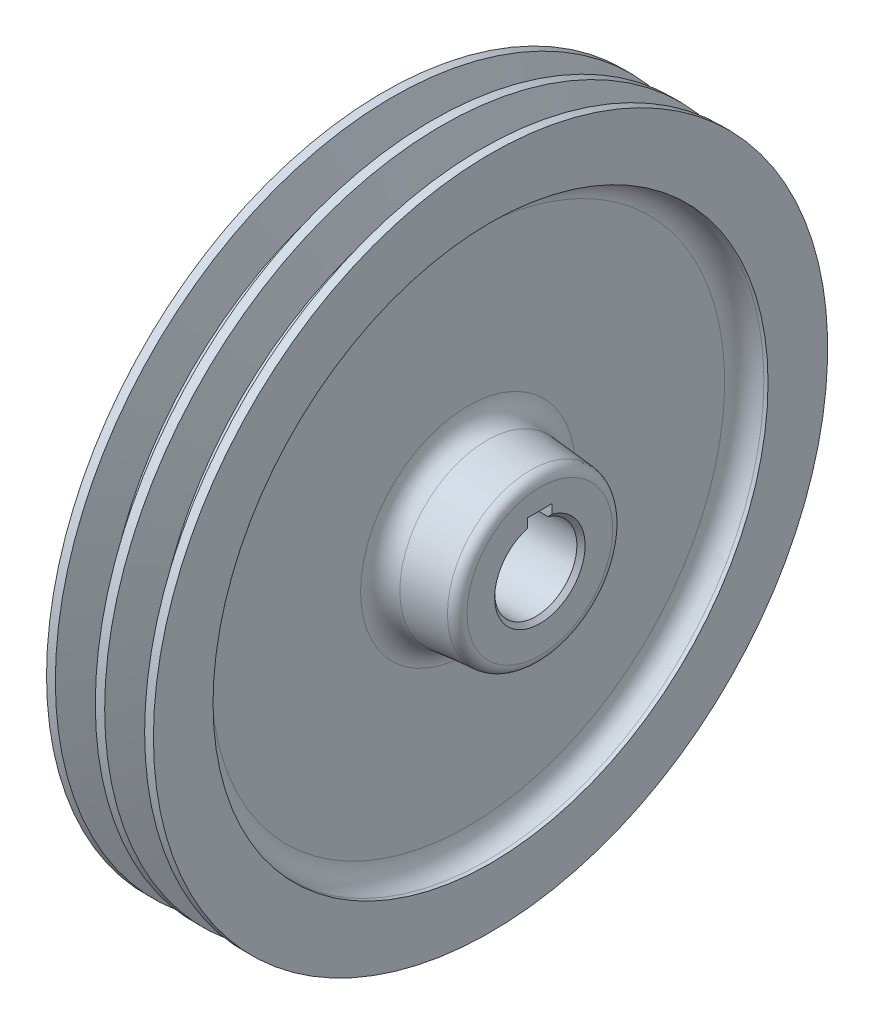
from build123d import *

# Parameters (mm, degrees)
PATTERN_LINEAR_999_COUNT = 2
PATTERN_LINEAR_999_PITCH = 12
CHAMFER_1_SIZE           = 1
SKETCH_4_W               = 6
SKETCH_4_H               = 3.260607938
CUT_EXTRUDE_1_DEPTH      = 127.285391079
FILLET_1_R               = 5
FILLET_2_R               = 2.5


with BuildPart() as part:
    # 草图1 → 旋转1 (revolve)
    with BuildSketch(Plane.XY, mode=Mode.PRIVATE) as revolve_1_sk:
        Polygon((-12, 10), (-12, 20), (5.5, 21.531051612), (5.5, 67.018812351), (0, 67.5), (0, 82), (26, 82), (26, 67.5), (20.5, 67.018812351), (20.5, 21.531051612), (38, 20), (38, 10), align=None)
    revolve(revolve_1_sk.sketch.rotate(Axis((0, 0, 0), (1, 0, 0)), 90), axis=Axis((0, 0, 0), (1, 0, 0)))

    # 草图2 → 切除-旋转1 (revolve, cut)
    with BuildSketch(Plane.XY, mode=Mode.PRIVATE) as cut_revolve_1_sk:
        Polygon((9.10988523, 73), (11.861461363, 82), (2.138538637, 82), (4.89011477, 73), align=None)
    cut_revolve_1 = revolve(cut_revolve_1_sk.sketch.rotate(Axis((0, 0, 0), (1, 0, 0)), 90), axis=Axis((0, 0, 0), (1, 0, 0)), mode=Mode.SUBTRACT)

    # Pattern Linear 999: 切除-旋转1 ×2
    with Locations(*[(i * PATTERN_LINEAR_999_PITCH, 0, 0) for i in range(1, PATTERN_LINEAR_999_COUNT)]):
        add(cut_revolve_1, mode=Mode.SUBTRACT)

    # 倒角1
    chamfer_1_edges = [part.edges().sort_by_distance(p)[0] for p in [
        (-12, 0, -10),
        (38, 0, -10),
    ]]
    chamfer(chamfer_1_edges, length=CHAMFER_1_SIZE)

    # 草图4 → 切除-拉伸1 (cut, through all)
    with BuildSketch(Plane.ZY.offset(12)):
        with Locations((0, 11.169695983)):
            Rectangle(SKETCH_4_W, SKETCH_4_H)
    extrude(amount=-CUT_EXTRUDE_1_DEPTH, mode=Mode.SUBTRACT)

    # 圆角1
    fillet_1_edges = [part.edges().sort_by_distance(p)[0] for p in [
        (5.5, 0, -67.018812351),
        (5.5, 0, -21.531051612),
        (20.5, 0, -21.531051612),
        (20.5, 0, -67.018812351),
    ]]
    fillet(fillet_1_edges, radius=FILLET_1_R)

    # 圆角2
    fillet_2_edges = [part.edges().sort_by_distance(p)[0] for p in [
        (-12, 0, -20),
        (38, 0, -20),
    ]]
    fillet(fillet_2_edges, radius=FILLET_2_R)


solid = part.part
